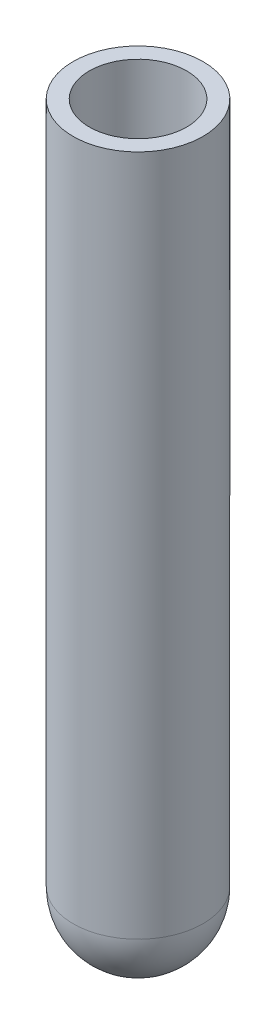
from build123d import *


with BuildPart() as part:
    # Croquis1 → Revolución1 (revolve)
    with BuildSketch(Plane.XY):
        with BuildLine():
            Line((8, -34), (8, 50))
            Line((8, 50), (6, 50))
            Line((6, 50), (6, -34))
            ThreePointArc((6, -34), (4.242640687, -38.242640687), (0, -40))
            Line((0, -40), (0, -42))
            ThreePointArc((0, -42), (5.656854249, -39.656854249), (8, -34))
        make_face()
    revolve(axis=Axis((0, 0, 0), (0, 1, 0)))


solid = part.part
